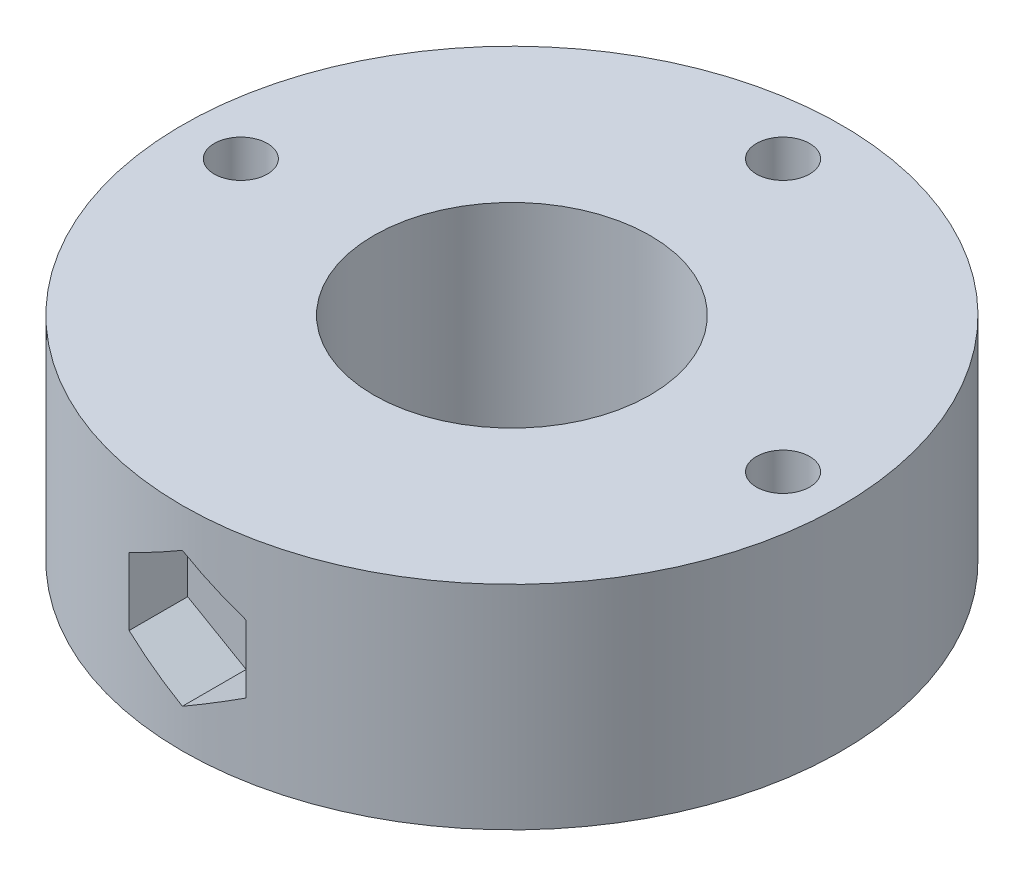
from build123d import *

# Parameters (mm, degrees)
SKETCH1_R           = 31
SKETCH1_R_2         = 13
SKETCH1_R_3         = 2.5
BOSS_EXTRUDE1_DEPTH = 20
CUT_EXTRUDE1_DEPTH  = 15


with BuildPart() as part:
    # Sketch1 → Boss-Extrude1 (new body)
    with BuildSketch(Plane(origin=(0, 0, 0), x_dir=(1, 0, 0), z_dir=(0, 1, 0))):
        with Locations(Location((0, 0, 0), (0, 0, 270))):
            Circle(SKETCH1_R)
        with Locations(Location((0, 0, 0), (0, 0, 270))):
            Circle(SKETCH1_R_2, mode=Mode.SUBTRACT)
        with Locations(Location((0, 25.5, 0), (0, 0, 270))):
            Circle(SKETCH1_R_3, mode=Mode.SUBTRACT)
        with Locations(Location((-25.5, 0, 0), (0, 0, 270))):
            Circle(SKETCH1_R_3, mode=Mode.SUBTRACT)
        with Locations(Location((25.5, 0, 0), (0, 0, 270))):
            Circle(SKETCH1_R_3, mode=Mode.SUBTRACT)
    extrude(amount=BOSS_EXTRUDE1_DEPTH)

    # Sketch3 → Cut-Extrude1 (cut)
    with BuildSketch(Plane.XY.offset(40)):
        Polygon((-5.5, 6.824573519), (0, 3.649147039), (5.5, 6.824573519), (5.5, 13.175426481), (0, 16.350852961), (-5.5, 13.175426481), align=None)
    extrude(amount=-CUT_EXTRUDE1_DEPTH, mode=Mode.SUBTRACT)


solid = part.part
